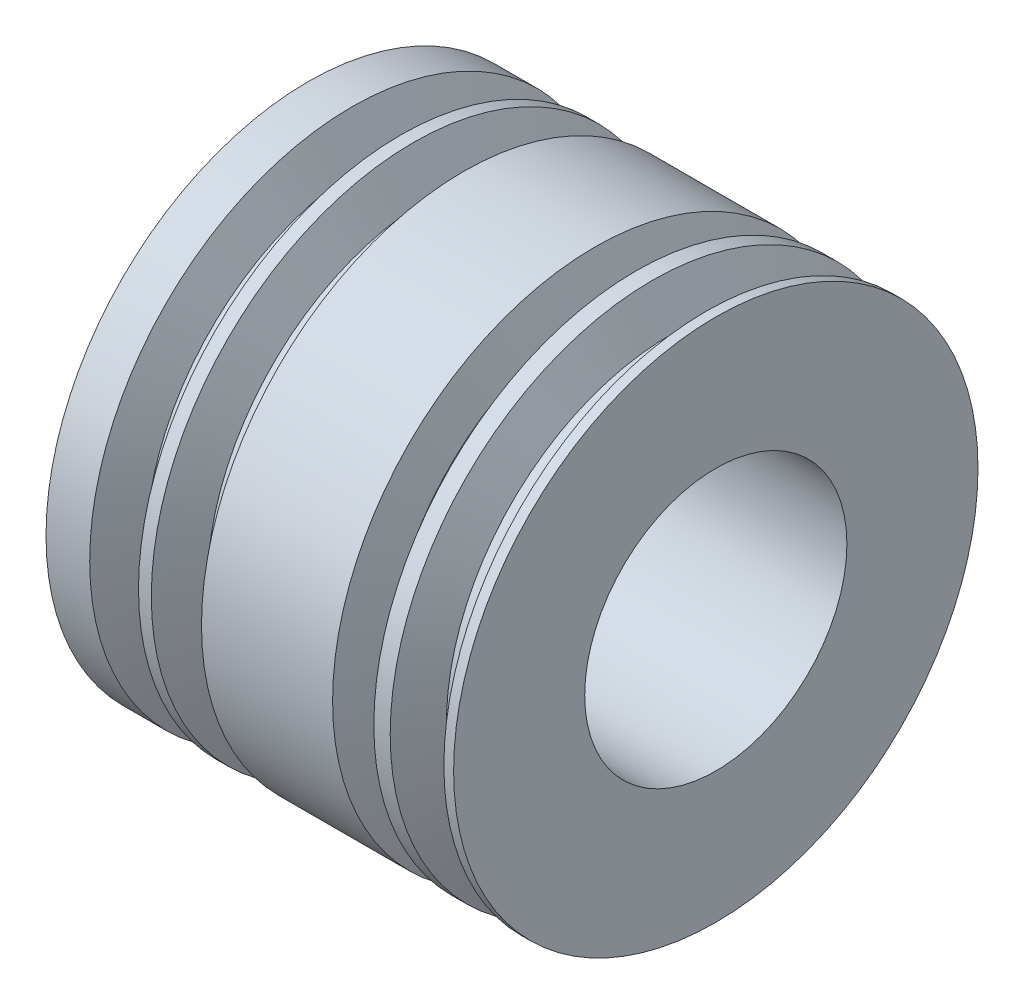
from build123d import *


with BuildPart() as part:
    # Szkic1 → Obrót1 (revolve)
    with BuildSketch(Plane.XY, mode=Mode.PRIVATE) as obr_t1_sk:
        Polygon((-2.127203461, 2.132645156), (-2.441762305, 3), (-5.441762305, 3), (-5.907929964, 2.132645156), (-6.17640763, 2.132645156), (-6.589993676, 3), (-6.883717364, 3), (-7.363713775, 2.132645156), (-7.586413954, 2.132645156), (-8, 3), (-9, 3), (-9, 0), (0, 0), (0.327556569, 0), (0.327556569, 3), (0.104856391, 3), (-0.177610191, 2.132645156), (-0.704199164, 2.132645156), (-1.123610957, 3), (-1.498085772, 3), (-1.81076161, 2.132645156), align=None)
    revolve(obr_t1_sk.sketch.rotate(Axis((0.327556569, -3, 0), (-1, 0, 0)), 90), axis=Axis((0.327556569, -3, 0), (-1, 0, 0)))


solid = part.part
